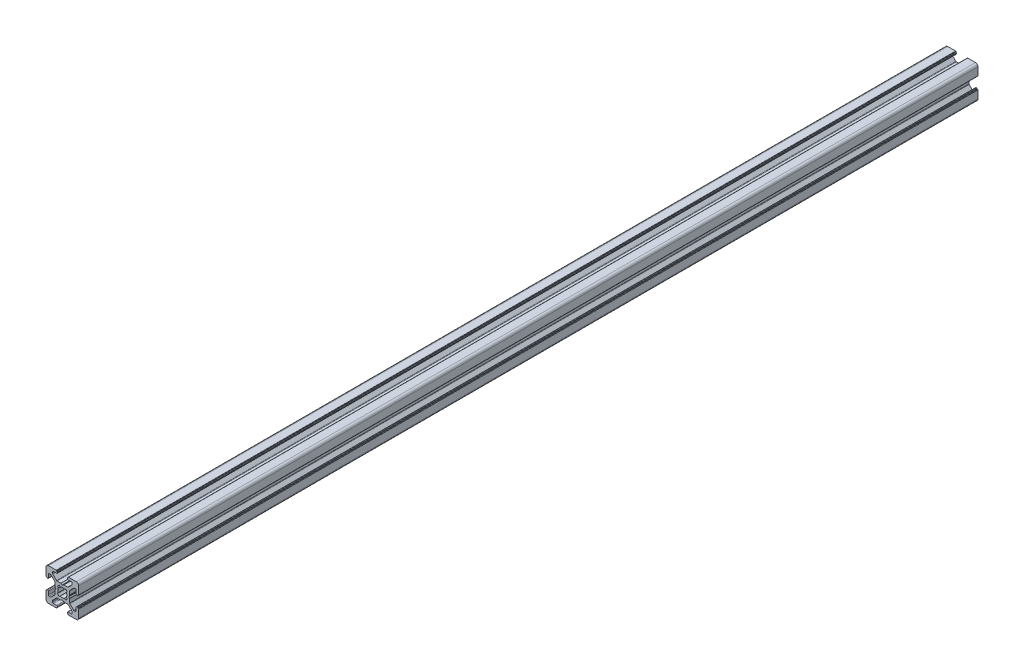
from build123d import *

# Parameters (mm, degrees)
EXTRUDE1_DEPTH = 550


with BuildPart() as part:
    # Sketch1 → Extrude1 (new body)
    with BuildSketch(Plane.XY):
        with BuildLine():
            Line((-3.5, 8.499999673), (-5.500000686, 8.499999673))
            ThreePointArc((-5.500000686, 8.499999673), (-5.853554077, 8.353553064), (-6.000000686, 7.999999673))
            Line((-6.000000686, 7.999999673), (-6.000000686, 7.267766626))
            ThreePointArc((-6.000000686, 7.267766626), (-5.961940448, 7.076424899), (-5.853554059, 6.914213219))
            Line((-5.853554059, 6.914213219), (-3.585787212, 4.646446592))
            ThreePointArc((-3.585787212, 4.646446592), (-3.423575544, 4.538060229), (-3.232233839, 4.5))
            Line((-3.232233839, 4.5), (-0.953590312, 4.5))
            ThreePointArc((-0.953590312, 4.5), (-0.901826505, 4.493185166), (-0.853590316, 4.473205083))
            Line((-0.853590316, 4.473205083), (-0.100000045, 4.038119562))
            ThreePointArc((-0.100000045, 4.038119562), (0, 4.011324632), (0.100000045, 4.038119562))
            Line((0.100000045, 4.038119562), (0.853590316, 4.473205083))
            ThreePointArc((0.853590316, 4.473205083), (0.901826505, 4.493185166), (0.953590312, 4.5))
            Line((0.953590312, 4.5), (3.232233839, 4.5))
            ThreePointArc((3.232233839, 4.5), (3.423575544, 4.538060229), (3.585787212, 4.646446592))
            Line((3.585787212, 4.646446592), (5.853554059, 6.914213219))
            ThreePointArc((5.853554059, 6.914213219), (5.961940448, 7.076424899), (6.000000686, 7.267766626))
            Line((6.000000686, 7.267766626), (6.000000686, 7.999999673))
            ThreePointArc((6.000000686, 7.999999673), (5.853554077, 8.353553064), (5.500000686, 8.499999673))
            Line((5.500000686, 8.499999673), (3.5, 8.499999673))
            ThreePointArc((3.5, 8.499999673), (3.146446609, 8.646446283), (3, 8.999999673))
            Line((3, 8.999999673), (3, 9.3))
            ThreePointArc((3, 9.3), (3.058578644, 9.441421356), (3.2, 9.5))
            Line((3.2, 9.5), (3.350000228, 9.5))
            ThreePointArc((3.350000228, 9.5), (3.491421584, 9.558578644), (3.550000228, 9.7))
            Line((3.550000228, 9.7), (3.550000228, 9.8))
            ThreePointArc((3.550000228, 9.8), (3.608578871, 9.941421356), (3.750000228, 10))
            Line((3.750000228, 10), (8.5, 10))
            ThreePointArc((8.5, 10), (9.560660172, 9.560660172), (10, 8.5))
            Line((10, 8.5), (10, 3.749999605))
            ThreePointArc((10, 3.749999605), (9.941421356, 3.608578248), (9.8, 3.549999605))
            Line((9.8, 3.549999605), (9.699999732, 3.549999605))
            ThreePointArc((9.699999732, 3.549999605), (9.558578376, 3.491420961), (9.499999732, 3.349999605))
            Line((9.499999732, 3.349999605), (9.499999732, 3.2))
            ThreePointArc((9.499999732, 3.2), (9.441421088, 3.058578644), (9.299999732, 3))
            Line((9.299999732, 3), (8.999999732, 3))
            ThreePointArc((8.999999732, 3), (8.646446341, 3.146446609), (8.499999732, 3.5))
            Line((8.499999732, 3.5), (8.499999732, 5.499999605))
            ThreePointArc((8.499999732, 5.499999605), (8.353553123, 5.853552995), (7.999999732, 5.999999605))
            Line((7.999999732, 5.999999605), (7.267766685, 5.999999605))
            ThreePointArc((7.267766685, 5.999999605), (7.076424969, 5.961939371), (6.914213294, 5.853552995))
            Line((6.914213294, 5.853552995), (4.646446398, 3.585786099))
            ThreePointArc((4.646446398, 3.585786099), (4.538060023, 3.423574425), (4.499999789, 3.232232708))
            Line((4.499999789, 3.232232708), (4.499999789, 0.953589302))
            ThreePointArc((4.499999789, 0.953589302), (4.493184953, 0.90182549), (4.473204867, 0.853589297))
            Line((4.473204867, 0.853589297), (4.038119841, 0.099999969))
            ThreePointArc((4.038119841, 0.099999969), (4.011324929, 0), (4.038119841, -0.099999969))
            Line((4.038119841, -0.099999969), (4.473204867, -0.853589297))
            ThreePointArc((4.473204867, -0.853589297), (4.493184953, -0.90182549), (4.499999789, -0.953589302))
            Line((4.499999789, -0.953589302), (4.499999789, -3.232232708))
            ThreePointArc((4.499999789, -3.232232708), (4.538060023, -3.423574425), (4.646446398, -3.585786099))
            Line((4.646446398, -3.585786099), (6.914213294, -5.853552995))
            ThreePointArc((6.914213294, -5.853552995), (7.076424969, -5.961939371), (7.267766685, -5.999999605))
            Line((7.267766685, -5.999999605), (7.999999732, -5.999999605))
            ThreePointArc((7.999999732, -5.999999605), (8.353553123, -5.853552995), (8.499999732, -5.499999605))
            Line((8.499999732, -5.499999605), (8.499999732, -3.5))
            ThreePointArc((8.499999732, -3.5), (8.646446341, -3.146446609), (8.999999732, -3))
            Line((8.999999732, -3), (9.299999732, -3))
            ThreePointArc((9.299999732, -3), (9.441421088, -3.058578644), (9.499999732, -3.2))
            Line((9.499999732, -3.2), (9.499999732, -3.349999605))
            ThreePointArc((9.499999732, -3.349999605), (9.558578376, -3.491420961), (9.699999732, -3.549999605))
            Line((9.699999732, -3.549999605), (9.8, -3.549999605))
            ThreePointArc((9.8, -3.549999605), (9.941421356, -3.608578248), (10, -3.749999605))
            Line((10, -3.749999605), (10, -8.5))
            ThreePointArc((10, -8.5), (9.560660172, -9.560660172), (8.5, -10))
            Line((8.5, -10), (3.750000228, -10))
            ThreePointArc((3.750000228, -10), (3.608578871, -9.941421356), (3.550000228, -9.8))
            Line((3.550000228, -9.8), (3.550000228, -9.7))
            ThreePointArc((3.550000228, -9.7), (3.491421584, -9.558578644), (3.350000228, -9.5))
            Line((3.350000228, -9.5), (3.2, -9.5))
            ThreePointArc((3.2, -9.5), (3.058578644, -9.441421356), (3, -9.3))
            Line((3, -9.3), (3, -8.999999673))
            ThreePointArc((3, -8.999999673), (3.146446609, -8.646446283), (3.5, -8.499999673))
            Line((3.5, -8.499999673), (5.500000686, -8.499999673))
            ThreePointArc((5.500000686, -8.499999673), (5.853554077, -8.353553064), (6.000000686, -7.999999673))
            Line((6.000000686, -7.999999673), (6.000000686, -7.267766626))
            ThreePointArc((6.000000686, -7.267766626), (5.961940448, -7.076424899), (5.853554059, -6.914213219))
            Line((5.853554059, -6.914213219), (3.585787212, -4.646446592))
            ThreePointArc((3.585787212, -4.646446592), (3.423575544, -4.538060229), (3.232233839, -4.5))
            Line((3.232233839, -4.5), (0.953590312, -4.5))
            ThreePointArc((0.953590312, -4.5), (0.901826505, -4.493185166), (0.853590316, -4.473205083))
            Line((0.853590316, -4.473205083), (0.100000045, -4.038119562))
            ThreePointArc((0.100000045, -4.038119562), (0, -4.011324632), (-0.100000045, -4.038119562))
            Line((-0.100000045, -4.038119562), (-0.853590316, -4.473205083))
            ThreePointArc((-0.853590316, -4.473205083), (-0.901826505, -4.493185166), (-0.953590312, -4.5))
            Line((-0.953590312, -4.5), (-3.232233839, -4.5))
            ThreePointArc((-3.232233839, -4.5), (-3.423575544, -4.538060229), (-3.585787212, -4.646446592))
            Line((-3.585787212, -4.646446592), (-5.853554059, -6.914213219))
            ThreePointArc((-5.853554059, -6.914213219), (-5.961940448, -7.076424899), (-6.000000686, -7.267766626))
            Line((-6.000000686, -7.267766626), (-6.000000686, -7.999999673))
            ThreePointArc((-6.000000686, -7.999999673), (-5.853554077, -8.353553064), (-5.500000686, -8.499999673))
            Line((-5.500000686, -8.499999673), (-3.5, -8.499999673))
            ThreePointArc((-3.5, -8.499999673), (-3.146446609, -8.646446283), (-3, -8.999999673))
            Line((-3, -8.999999673), (-3, -9.3))
            ThreePointArc((-3, -9.3), (-3.058578644, -9.441421356), (-3.2, -9.5))
            Line((-3.2, -9.5), (-3.350000228, -9.5))
            ThreePointArc((-3.350000228, -9.5), (-3.491421584, -9.558578644), (-3.550000228, -9.7))
            Line((-3.550000228, -9.7), (-3.550000228, -9.8))
            ThreePointArc((-3.550000228, -9.8), (-3.608578871, -9.941421356), (-3.750000228, -10))
            Line((-3.750000228, -10), (-8.5, -10))
            ThreePointArc((-8.5, -10), (-9.560660172, -9.560660172), (-10, -8.5))
            Line((-10, -8.5), (-10, -3.749999605))
            ThreePointArc((-10, -3.749999605), (-9.941421356, -3.608578248), (-9.8, -3.549999605))
            Line((-9.8, -3.549999605), (-9.699999732, -3.549999605))
            ThreePointArc((-9.699999732, -3.549999605), (-9.558578376, -3.491420961), (-9.499999732, -3.349999605))
            Line((-9.499999732, -3.349999605), (-9.499999732, -3.2))
            ThreePointArc((-9.499999732, -3.2), (-9.441421088, -3.058578644), (-9.299999732, -3))
            Line((-9.299999732, -3), (-8.999999732, -3))
            ThreePointArc((-8.999999732, -3), (-8.646446341, -3.146446609), (-8.499999732, -3.5))
            Line((-8.499999732, -3.5), (-8.499999732, -5.499999605))
            ThreePointArc((-8.499999732, -5.499999605), (-8.353553123, -5.853552995), (-7.999999732, -5.999999605))
            Line((-7.999999732, -5.999999605), (-7.267766685, -5.999999605))
            ThreePointArc((-7.267766685, -5.999999605), (-7.076424969, -5.961939371), (-6.914213294, -5.853552995))
            Line((-6.914213294, -5.853552995), (-4.646446398, -3.585786099))
            ThreePointArc((-4.646446398, -3.585786099), (-4.538060023, -3.423574425), (-4.499999789, -3.232232708))
            Line((-4.499999789, -3.232232708), (-4.499999789, -0.953589302))
            ThreePointArc((-4.499999789, -0.953589302), (-4.493184953, -0.90182549), (-4.473204867, -0.853589297))
            Line((-4.473204867, -0.853589297), (-4.038119841, -0.099999969))
            ThreePointArc((-4.038119841, -0.099999969), (-4.011324929, 0), (-4.038119841, 0.099999969))
            Line((-4.038119841, 0.099999969), (-4.473204867, 0.853589297))
            ThreePointArc((-4.473204867, 0.853589297), (-4.493184953, 0.90182549), (-4.499999789, 0.953589302))
            Line((-4.499999789, 0.953589302), (-4.499999789, 3.232232708))
            ThreePointArc((-4.499999789, 3.232232708), (-4.538060023, 3.423574425), (-4.646446398, 3.585786099))
            Line((-4.646446398, 3.585786099), (-6.914213294, 5.853552995))
            ThreePointArc((-6.914213294, 5.853552995), (-7.076424969, 5.961939371), (-7.267766685, 5.999999605))
            Line((-7.267766685, 5.999999605), (-7.999999732, 5.999999605))
            ThreePointArc((-7.999999732, 5.999999605), (-8.353553123, 5.853552995), (-8.499999732, 5.499999605))
            Line((-8.499999732, 5.499999605), (-8.499999732, 3.5))
            ThreePointArc((-8.499999732, 3.5), (-8.646446341, 3.146446609), (-8.999999732, 3))
            Line((-8.999999732, 3), (-9.299999732, 3))
            ThreePointArc((-9.299999732, 3), (-9.441421088, 3.058578644), (-9.499999732, 3.2))
            Line((-9.499999732, 3.2), (-9.499999732, 3.349999605))
            ThreePointArc((-9.499999732, 3.349999605), (-9.558578376, 3.491420961), (-9.699999732, 3.549999605))
            Line((-9.699999732, 3.549999605), (-9.8, 3.549999605))
            ThreePointArc((-9.8, 3.549999605), (-9.941421356, 3.608578248), (-10, 3.749999605))
            Line((-10, 3.749999605), (-10, 8.5))
            ThreePointArc((-10, 8.5), (-9.560660172, 9.560660172), (-8.5, 10))
            Line((-8.5, 10), (-3.750000228, 10))
            ThreePointArc((-3.750000228, 10), (-3.608578871, 9.941421356), (-3.550000228, 9.8))
            Line((-3.550000228, 9.8), (-3.550000228, 9.7))
            ThreePointArc((-3.550000228, 9.7), (-3.491421584, 9.558578644), (-3.350000228, 9.5))
            Line((-3.350000228, 9.5), (-3.2, 9.5))
            ThreePointArc((-3.2, 9.5), (-3.058578644, 9.441421356), (-3, 9.3))
            Line((-3, 9.3), (-3, 8.999999673))
            ThreePointArc((-3, 8.999999673), (-3.146446609, 8.646446283), (-3.5, 8.499999673))
        make_face()
        with BuildLine():
            Line((-1.258185436, 2.445295362), (-1.91389502, 2.989640962))
            ThreePointArc((-1.91389502, 2.989640962), (-2.511737261, 2.508410485), (-2.992174953, 1.909930962))
            Line((-2.992174953, 1.909930962), (-2.445295423, 1.258185317))
            ThreePointArc((-2.445295423, 1.258185317), (-2.75, 0), (-2.445295423, -1.258185317))
            Line((-2.445295423, -1.258185317), (-2.992174953, -1.909930962))
            ThreePointArc((-2.992174953, -1.909930962), (-2.511737261, -2.508410485), (-1.91389502, -2.989640962))
            Line((-1.91389502, -2.989640962), (-1.258185436, -2.445295362))
            ThreePointArc((-1.258185436, -2.445295362), (0, -2.75), (1.258185436, -2.445295362))
            Line((1.258185436, -2.445295362), (1.91389502, -2.989640962))
            ThreePointArc((1.91389502, -2.989640962), (2.511737261, -2.508410485), (2.992174953, -1.909930962))
            Line((2.992174953, -1.909930962), (2.445295423, -1.258185317))
            ThreePointArc((2.445295423, -1.258185317), (2.75, 0), (2.445295423, 1.258185317))
            Line((2.445295423, 1.258185317), (2.992174953, 1.909930962))
            ThreePointArc((2.992174953, 1.909930962), (2.511737261, 2.508410485), (1.91389502, 2.989640962))
            Line((1.91389502, 2.989640962), (1.258185436, 2.445295362))
            ThreePointArc((1.258185436, 2.445295362), (0, 2.75), (-1.258185436, 2.445295362))
        make_face(mode=Mode.SUBTRACT)
    extrude(amount=EXTRUDE1_DEPTH)


solid = part.part
